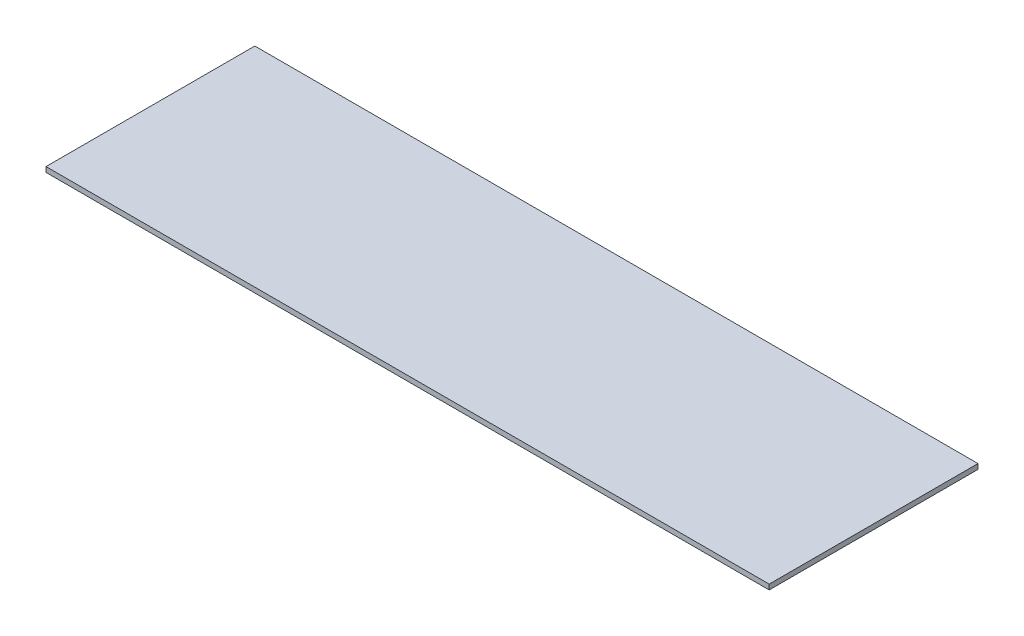
from build123d import *

# Parameters (mm, degrees)
SKETCH1_W           = 450.85
SKETCH1_H           = 130.175
BOSS_EXTRUDE1_DEPTH = 3.175


with BuildPart() as part:
    # Sketch1 → Boss-Extrude1 (new body)
    with BuildSketch(Plane(origin=(0, 0, 0), x_dir=(1, 0, 0), z_dir=(0, 1, 0))):
        with Locations((152.602066407, 25.458955816)):
            Rectangle(SKETCH1_W, SKETCH1_H)
    extrude(amount=-BOSS_EXTRUDE1_DEPTH)


solid = part.part
